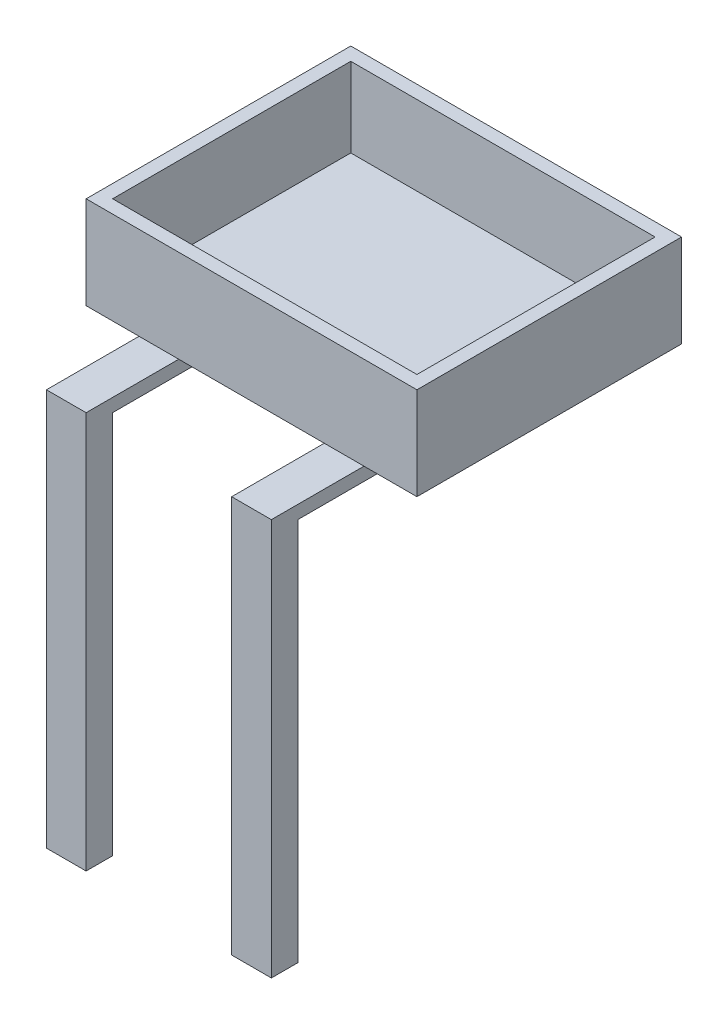
from build123d import *

# Parameters (mm, degrees)
CROQUIS1_W              = 250
CROQUIS1_H              = 200
SALIENTE_EXTRUIR1_DEPTH = 10
CROQUIS2_W              = 250
CROQUIS2_H              = 200
CROQUIS2_W_2            = 230
CROQUIS2_H_2            = 180
SALIENTE_EXTRUIR2_DEPTH = 60
CROQUIS3_W              = 30
CROQUIS3_H              = 270
SALIENTE_EXTRUIR3_DEPTH = 10
CROQUIS4_W              = 30
CROQUIS4_H              = 20
SALIENTE_EXTRUIR4_DEPTH = 290


with BuildPart() as part:
    # Croquis1 → Saliente-Extruir1 (new body)
    with BuildSketch(Plane(origin=(0, 0, 0), x_dir=(1, 0, 0), z_dir=(0, 1, 0))):
        Rectangle(CROQUIS1_W, CROQUIS1_H)
    extrude(amount=SALIENTE_EXTRUIR1_DEPTH)

    # Croquis2 → Saliente-Extruir2 (add)
    with BuildSketch(Plane(origin=(0, 10, 0), x_dir=(1, 0, 0), z_dir=(0, 1, 0))):
        Rectangle(CROQUIS2_W, CROQUIS2_H)
        Rectangle(CROQUIS2_W_2, CROQUIS2_H_2, mode=Mode.SUBTRACT)
    extrude(amount=SALIENTE_EXTRUIR2_DEPTH)

    # Croquis3 → Saliente-Extruir3 (add)
    with BuildSketch(Plane.XZ):
        with Locations((-70, 35)):
            Rectangle(CROQUIS3_W, CROQUIS3_H)
        with Locations((70, 35)):
            Rectangle(CROQUIS3_W, CROQUIS3_H)
    extrude(amount=SALIENTE_EXTRUIR3_DEPTH)

    # Croquis4 → Saliente-Extruir4 (add)
    with BuildSketch(Plane.XZ.offset(10)):
        with Locations((-70, 160)):
            Rectangle(CROQUIS4_W, CROQUIS4_H)
        with Locations((70, 160)):
            Rectangle(CROQUIS4_W, CROQUIS4_H)
    extrude(amount=SALIENTE_EXTRUIR4_DEPTH)


solid = part.part
